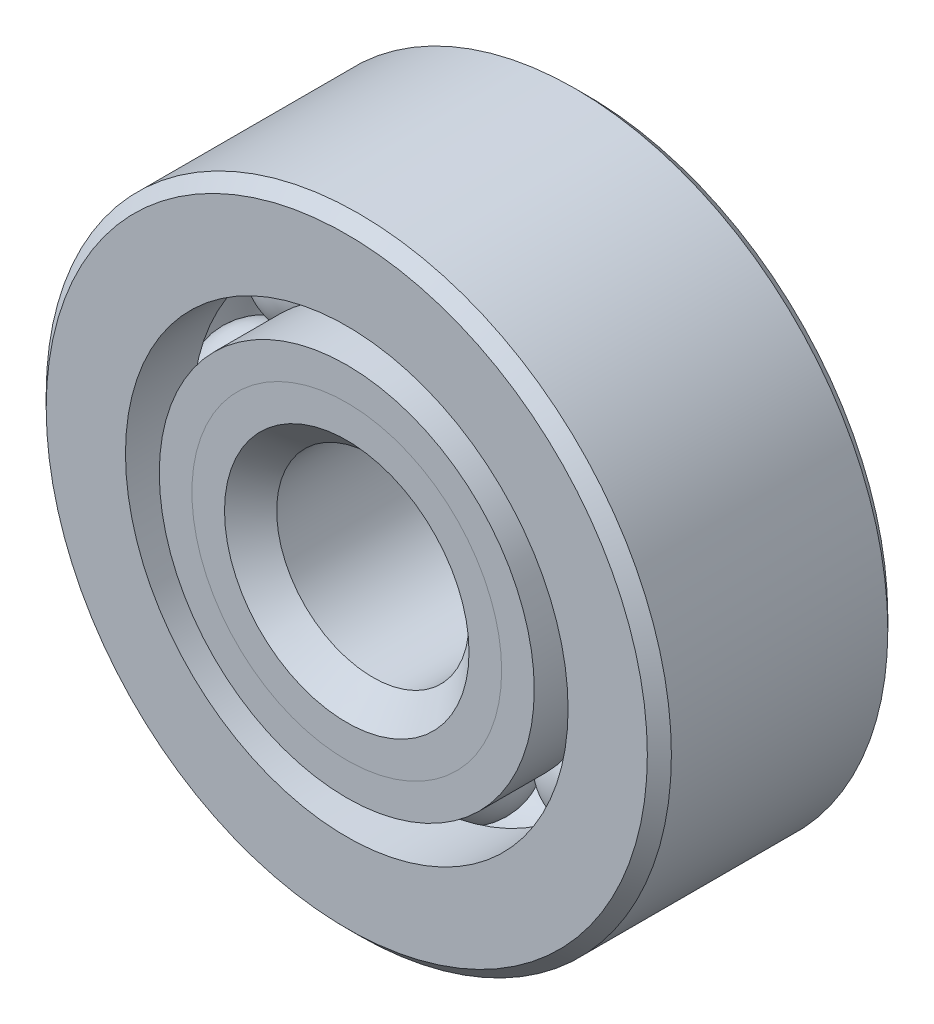
from build123d import *

# Parameters (mm, degrees)
CIRPATTERN1_COUNT = 8


with BuildPart() as part:
    # Sketch1 → Revolve1 (revolve)
    with BuildSketch(Plane(origin=(0, 0, 0), x_dir=(0, 0, -1), z_dir=(1, 0, 0))):
        with BuildLine():
            Line((2.25, 6.5), (-2.25, 6.5))
            Line((-2.25, 6.5), (-2.5, 6.25))
            Line((-2.5, 6.25), (-2.5, 4.601648352))
            Line((-2.5, 4.601648352), (-1.111111111, 4.601648352))
            ThreePointArc((-1.111111111, 4.601648352), (0, 5.415428876), (1.111111111, 4.601648352))
            Line((1.111111111, 4.601648352), (2.5, 4.601648352))
            Line((2.5, 4.601648352), (2.5, 6.25))
            Line((2.5, 6.25), (2.25, 6.5))
        make_face()
    revolve(axis=Axis((0, 0, 2.5), (0, 0, -1)))


with BuildPart() as body_2:
    # Sketch2 → Revolve2 (revolve)
    with BuildSketch(Plane(origin=(0, 0, 0), x_dir=(0, 0, -1), z_dir=(1, 0, 0))):
        with BuildLine():
            Line((-2.5, 3.898351648), (-1.111111111, 3.898351648))
            ThreePointArc((-1.111111111, 3.898351648), (-0.688623018, 3.309775131), (0, 3.084571124))
            Line((0, 3.084571124), (0, 2.542285562))
            Line((0, 2.542285562), (-1.821966957, 2.542285562))
            Line((-1.821966957, 2.542285562), (-2.5, 3.220318605))
            Line((-2.5, 3.220318605), (-2.5, 3.898351648))
        make_face()
    revolve(axis=Axis((0, 0, 2.5), (0, 0, -1)))


with BuildPart() as body_3:
    # Sketch3 → Revolve3 (revolve)
    with BuildSketch(Plane(origin=(0, 0, 0), x_dir=(0, 0, -1), z_dir=(1, 0, 0))):
        with BuildLine():
            Line((-2.5, 3.220318605), (-1.821966957, 2.542285562))
            Line((-1.821966957, 2.542285562), (0, 2.542285562))
            Line((0, 2.542285562), (0, 3.084571124))
            ThreePointArc((0, 3.084571124), (0.688623018, 3.309775131), (1.111111111, 3.898351648))
            Line((1.111111111, 3.898351648), (2.5, 3.898351648))
            Line((2.5, 3.898351648), (2.5, 2.25))
            Line((2.5, 2.25), (2.25, 2))
            Line((2.25, 2), (-1.957714438, 2))
            Line((-1.957714438, 2), (-2.5, 2.542285562))
            Line((-2.5, 2.542285562), (-2.5, 3.220318605))
        make_face()
    revolve(axis=Axis((0, 0, 2.5), (0, 0, -1)))


with BuildPart() as body_4:
    # Sketch4 → Revolve4 (revolve)
    with BuildSketch(Plane(origin=(0, 0, 0), x_dir=(0, 0, -1), z_dir=(1, 0, 0))):
        with BuildLine():
            Line((-1.165428876, 4.25), (1.165428876, 4.25))
            ThreePointArc((1.165428876, 4.25), (0, 5.415428876), (-1.165428876, 4.25))
        make_face()
    revolve(axis=Axis((0, 4.25, 1.165428876), (0, 0, -1)))


with BuildPart() as cirpattern1_1:
    # CirPattern1: pattern copy
    add(body_4.part.rotate(Axis((0, 0, -2.5), (0, 0, 1)), 1 * 360 / CIRPATTERN1_COUNT))


with BuildPart() as cirpattern1_2:
    # CirPattern1: pattern copy
    add(body_4.part.rotate(Axis((0, 0, -2.5), (0, 0, 1)), 2 * 360 / CIRPATTERN1_COUNT))


with BuildPart() as cirpattern1_3:
    # CirPattern1: pattern copy
    add(body_4.part.rotate(Axis((0, 0, -2.5), (0, 0, 1)), 3 * 360 / CIRPATTERN1_COUNT))


with BuildPart() as cirpattern1_4:
    # CirPattern1: pattern copy
    add(body_4.part.rotate(Axis((0, 0, -2.5), (0, 0, 1)), 4 * 360 / CIRPATTERN1_COUNT))


with BuildPart() as cirpattern1_5:
    # CirPattern1: pattern copy
    add(body_4.part.rotate(Axis((0, 0, -2.5), (0, 0, 1)), 5 * 360 / CIRPATTERN1_COUNT))


with BuildPart() as cirpattern1_6:
    # CirPattern1: pattern copy
    add(body_4.part.rotate(Axis((0, 0, -2.5), (0, 0, 1)), 6 * 360 / CIRPATTERN1_COUNT))


with BuildPart() as cirpattern1_7:
    # CirPattern1: pattern copy
    add(body_4.part.rotate(Axis((0, 0, -2.5), (0, 0, 1)), 7 * 360 / CIRPATTERN1_COUNT))


solid = Compound([part.part, body_2.part, body_3.part, body_4.part, cirpattern1_1.part, cirpattern1_2.part, cirpattern1_3.part, cirpattern1_4.part, cirpattern1_5.part, cirpattern1_6.part, cirpattern1_7.part])
